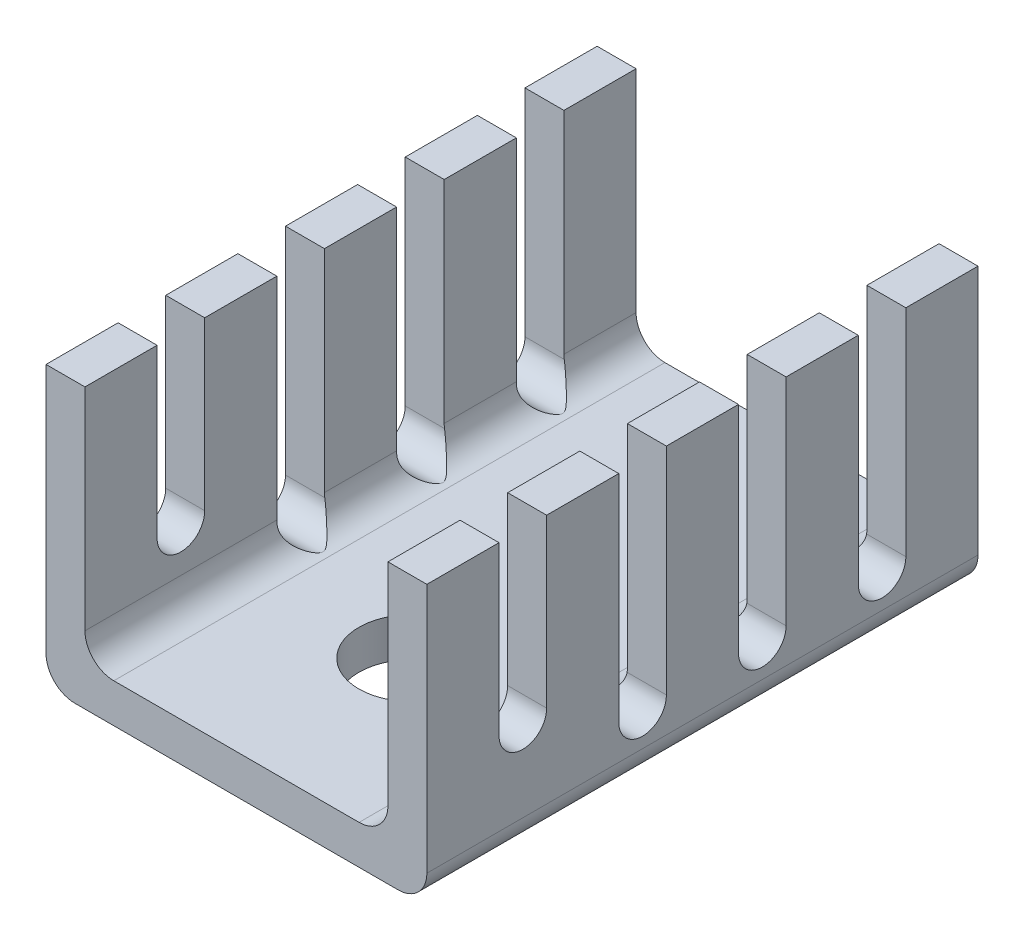
from build123d import *

# Parameters (mm, degrees)
BOSS_EXTRUDE3_DEPTH = 19.1
CUT_EXTRUDE2_REACH  = 23.854
SKETCH3_R           = 1.85
CUT_EXTRUDE3_DEPTH  = 26.150723648


with BuildPart() as part:
    # Sketch1 → Boss-Extrude3 (new body)
    with BuildSketch(Plane.XY):
        with BuildLine():
            Line((-5.6, 0), (5.6, 0))
            ThreePointArc((5.6, 0), (6.307106781, 0.292893219), (6.6, 1))
            Line((6.6, 1), (6.6, 9.67))
            Line((6.6, 9.67), (5.25, 9.67))
            Line((5.25, 9.67), (5.25, 2.35))
            ThreePointArc((5.25, 2.35), (4.957106781, 1.642893219), (4.25, 1.35))
            Line((4.25, 1.35), (-4.25, 1.35))
            ThreePointArc((-4.25, 1.35), (-4.957106781, 1.642893219), (-5.25, 2.35))
            Line((-5.25, 2.35), (-5.25, 9.67))
            Line((-5.25, 9.67), (-6.6, 9.67))
            Line((-6.6, 9.67), (-6.6, 1))
            ThreePointArc((-6.6, 1), (-6.307106781, 0.292893219), (-5.6, 0))
        make_face()
    extrude(amount=-BOSS_EXTRUDE3_DEPTH)

    # Sketch3 → Cut-Extrude2 (cut, up to next)
    with BuildSketch(Plane(origin=(0, 1.35, 0), x_dir=(1, 0, 0), z_dir=(0, 1, 0)), mode=Mode.PRIVATE) as cut_extrude2_sk1:
        with Locations(Location((0.241401012, 5.85, 0), (0, 0, 270))):
            Circle(SKETCH3_R)
    cut_extrude2_tool1 = extrude(cut_extrude2_sk1.sketch, amount=-CUT_EXTRUDE2_REACH, mode=Mode.PRIVATE) & part.part
    add(cut_extrude2_tool1.solids().sort_by_distance((0.241401, 1.35, -5.85))[0], mode=Mode.SUBTRACT)

    # Sketch4 → Cut-Extrude3 (cut, through all)
    with BuildSketch(Plane(origin=(6.6, 0, 0), x_dir=(0, 0, -1), z_dir=(1, 0, 0))):
        with BuildLine():
            Line((2.5, 9.67), (2.5, 3.88))
            ThreePointArc((2.5, 3.88), (3.325, 3.055), (4.15, 3.88))
            Line((4.15, 3.88), (4.15, 9.67))
            Line((4.15, 9.67), (2.5, 9.67))
        make_face()
        with BuildLine():
            Line((6.65, 9.67), (6.65, 2.2))
            ThreePointArc((6.65, 2.2), (7.475, 1.375), (8.3, 2.2))
            Line((8.3, 2.2), (8.3, 9.67))
            Line((8.3, 9.67), (6.65, 9.67))
        make_face()
        with BuildLine():
            Line((10.8, 9.67), (10.8, 2.2))
            ThreePointArc((10.8, 2.2), (11.625, 1.375), (12.45, 2.2))
            Line((12.45, 2.2), (12.45, 9.67))
            Line((12.45, 9.67), (10.8, 9.67))
        make_face()
        with BuildLine():
            Line((14.95, 9.67), (14.95, 2.2))
            ThreePointArc((14.95, 2.2), (15.775, 1.375), (16.6, 2.2))
            Line((16.6, 2.2), (16.6, 9.67))
            Line((16.6, 9.67), (14.95, 9.67))
        make_face()
    extrude(amount=-CUT_EXTRUDE3_DEPTH, mode=Mode.SUBTRACT)


solid = part.part
